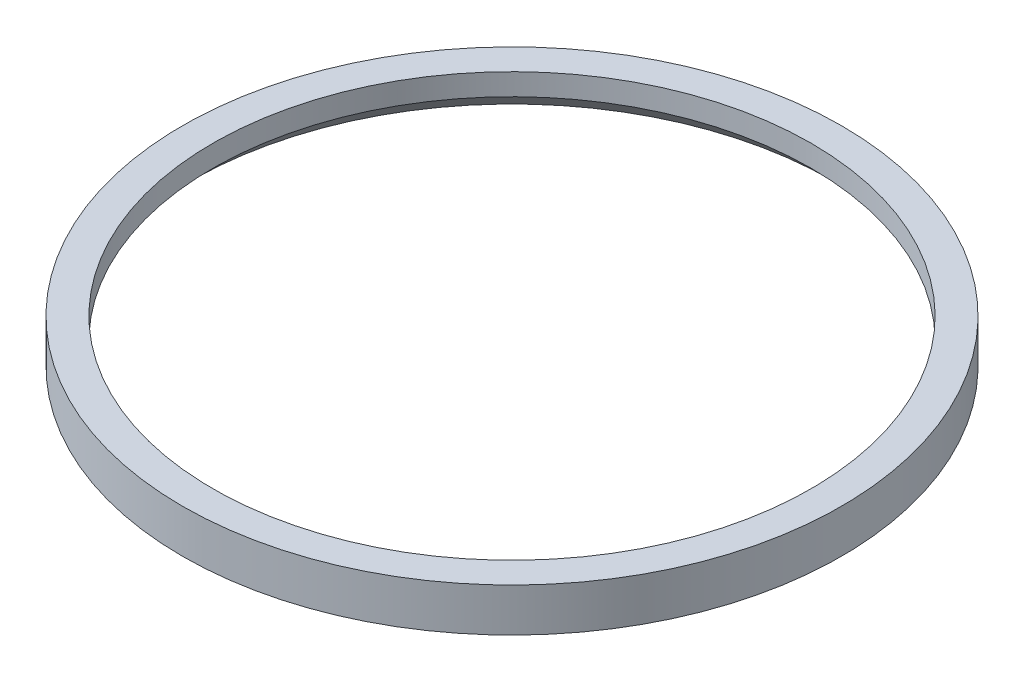
from build123d import *


with BuildPart() as part:
    # Sketch1 → Revolve1 (revolve)
    with BuildSketch(Plane.XY, mode=Mode.PRIVATE) as revolve1_sk:
        Polygon((19, 0), (19, 2.5), (17.25, 2.5), (17.25, 1.25), (18.5, 0), align=None)
    revolve(revolve1_sk.sketch.rotate(Axis((0, 0, 0), (0, 1, 0)), 90), axis=Axis((0, 0, 0), (0, 1, 0)))


solid = part.part
